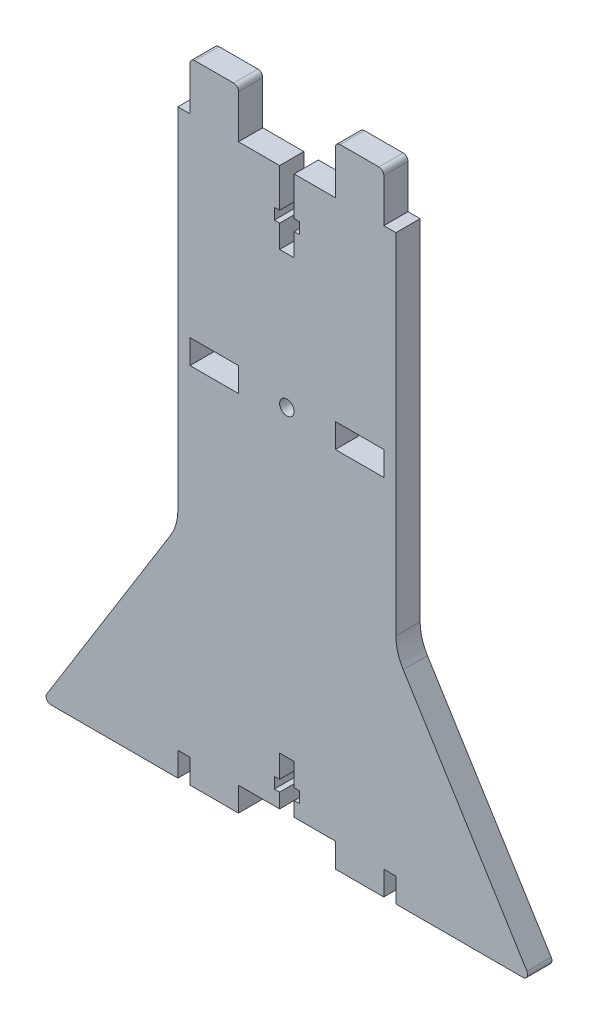
from build123d import *

# Parameters (mm, degrees)
BOSS_EXTRUDE1_DEPTH = 5
SKETCH2_R           = 1.5
SKETCH2_W           = 10
SKETCH2_H           = 5
CUT_EXTRUDE1_DEPTH  = 10
FILLET1_R           = 10
FILLET2_R           = 1
CONG_1_R            = 1


with BuildPart() as part:
    # Sketch1 → Boss-Extrude1 (new body)
    with BuildSketch(Plane.XY):
        Polygon((-32.518889855, -56.191512275), (-30.018889855, -56.191512275), (-30.018889855, -61.191512275), (-20.018889855, -61.191512275), (-20.018889855, -56.191512275), (-11.518889855, -56.191512275), (-11.518889855, -53.191512275), (-12.618889855, -53.191512275), (-12.618889855, -50.891512275), (-11.518889855, -50.891512275), (-11.518889855, -46.191512275), (-8.518889855, -46.191512275), (-8.518889855, -50.891512275), (-7.418889855, -50.891512275), (-7.418889855, -53.191512275), (-8.518889855, -53.191512275), (-8.518889855, -56.191512275), (-0.018889855, -56.191512275), (-0.018889855, -61.191512275), (9.981110145, -61.191512275), (9.981110145, -56.191512275), (12.481110145, -56.191512275), (12.481110145, -61.191512275), (40.481110145, -61.191512275), (12.481110145, -16.103821473), (12.481110145, 58.808487725), (9.981110145, 58.808487725), (9.981110145, 68.808487725), (-0.018889855, 68.808487725), (-0.018889855, 58.808487725), (-8.518889855, 58.808487725), (-8.518889855, 50.808487725), (-7.418889855, 50.808487725), (-7.418889855, 48.508487725), (-8.518889855, 48.508487725), (-8.518889855, 43.808487725), (-11.518889855, 43.808487725), (-11.518889855, 48.508487725), (-12.618889855, 48.508487725), (-12.618889855, 50.808487725), (-11.518889855, 50.808487725), (-11.518889855, 58.808487725), (-20.018889855, 58.808487725), (-20.018889855, 68.808487725), (-30.018889855, 68.808487725), (-30.018889855, 58.808487725), (-32.518889855, 58.808487725), (-32.518889855, -16.103821473), (-60.518889855, -61.191512275), (-32.518889855, -61.191512275), align=None)
    extrude(amount=BOSS_EXTRUDE1_DEPTH)

    # Sketch2 → Cut-Extrude1 (cut)
    with BuildSketch(Plane.XY.offset(5)):
        with Locations((-10.018889855, 16.308487725)):
            Circle(SKETCH2_R)
        with Locations((-25.018889855, 16.308487725)):
            Rectangle(SKETCH2_W, SKETCH2_H)
        with Locations((4.981110145, 16.308487725)):
            Rectangle(SKETCH2_W, SKETCH2_H)
    extrude(amount=-CUT_EXTRUDE1_DEPTH, mode=Mode.SUBTRACT)

    # Fillet1
    fillet1_edges = [part.edges().sort_by_distance(p)[0] for p in [
        (-32.518889855, -16.103821473, 2.5),
        (12.481110145, -16.103821473, 2.5),
    ]]
    fillet(fillet1_edges, radius=FILLET1_R)

    # Fillet2
    fillet2_edges = [part.edges().sort_by_distance(p)[0] for p in [
        (40.481110145, -61.191512275, 2.5),
        (-60.518889855, -61.191512275, 2.5),
    ]]
    fillet(fillet2_edges, radius=FILLET2_R)

    # Congé1
    cong_1_edges = [part.edges().sort_by_distance(p)[0] for p in [
        (-30.018889855, 68.808487725, 2.5),
        (-20.018889855, 68.808487725, 2.5),
        (-0.018889855, 68.808487725, 2.5),
        (9.981110145, 68.808487725, 2.5),
    ]]
    fillet(cong_1_edges, radius=CONG_1_R)


solid = part.part
